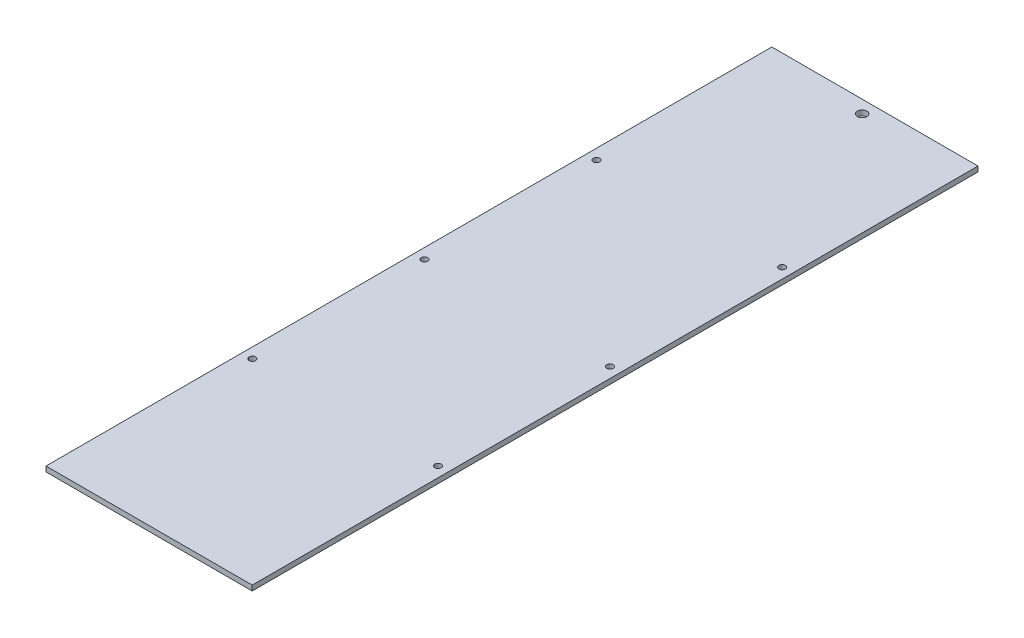
from build123d import *

# Parameters (mm, degrees)
SKETCH1_W               = 80
SKETCH1_H               = 281.62
BOSS_EXTRUDE1_DEPTH     = 2
SKETCH2_R               = 1.85
CUT_EXTRUDE1_DEPTH      = 2
SKETCH3_R               = 1.25
CUT_EXTRUDE2_DEPTH      = 2
LPATTERN1_COUNT         = 3
LPATTERN1_PITCH         = 66.76
MIRROR1_COPY_1_SKETCH_R = 1.25
MIRROR1_COPY_1_DEPTH    = 2
MIRROR1_COPY_2_SKETCH_R = 1.25
MIRROR1_COPY_2_DEPTH    = 2


with BuildPart() as part:
    # Sketch1 → Boss-Extrude1 (new body)
    with BuildSketch(Plane(origin=(0, 0, 0), x_dir=(1, 0, 0), z_dir=(0, 1, 0))):
        Rectangle(SKETCH1_W, SKETCH1_H)
    extrude(amount=BOSS_EXTRUDE1_DEPTH)

    # Sketch2 → Cut-Extrude1 (cut)
    with BuildSketch(Plane(origin=(0, 2, 0), x_dir=(1, 0, 0), z_dir=(0, 1, 0))):
        with Locations(Location((0, 135.87, 0), (0, 0, 270))):
            Circle(SKETCH2_R)
    extrude(amount=-CUT_EXTRUDE1_DEPTH, mode=Mode.SUBTRACT)

    # Sketch3 → Cut-Extrude2 (cut)
    with BuildSketch(Plane(origin=(0, 2, 0), x_dir=(1, 0, 0), z_dir=(0, 1, 0))):
        with Locations(Location((-36, 68.81, 0), (0, 0, 270))):
            Circle(SKETCH3_R)
    cut_extrude2 = extrude(amount=-CUT_EXTRUDE2_DEPTH, mode=Mode.SUBTRACT)

    # LPattern1: Cut-Extrude2 ×3
    with Locations(*[(0, 0, i * LPATTERN1_PITCH) for i in range(1, LPATTERN1_COUNT)]):
        add(cut_extrude2, mode=Mode.SUBTRACT)

    # Mirror1: Cut-Extrude2 across plane
    add(cut_extrude2.mirror(Plane(origin=(0, 0, 0), x_dir=(0, 0, 1), z_dir=(1, 0, 0))), mode=Mode.SUBTRACT)

    # Mirror1 copy 1 sketch → Mirror1 copy 1 (cut)
    with BuildSketch(Plane(origin=(0, 2, 66.76), x_dir=(-1, 0, 0), z_dir=(0, 1, 0))):
        with Locations((-36, -68.81)):
            Circle(MIRROR1_COPY_1_SKETCH_R)
    extrude(amount=-MIRROR1_COPY_1_DEPTH, mode=Mode.SUBTRACT)

    # Mirror1 copy 2 sketch → Mirror1 copy 2 (cut)
    with BuildSketch(Plane(origin=(0, 2, 133.52), x_dir=(-1, 0, 0), z_dir=(0, 1, 0))):
        with Locations((-36, -68.81)):
            Circle(MIRROR1_COPY_2_SKETCH_R)
    extrude(amount=-MIRROR1_COPY_2_DEPTH, mode=Mode.SUBTRACT)


solid = part.part
